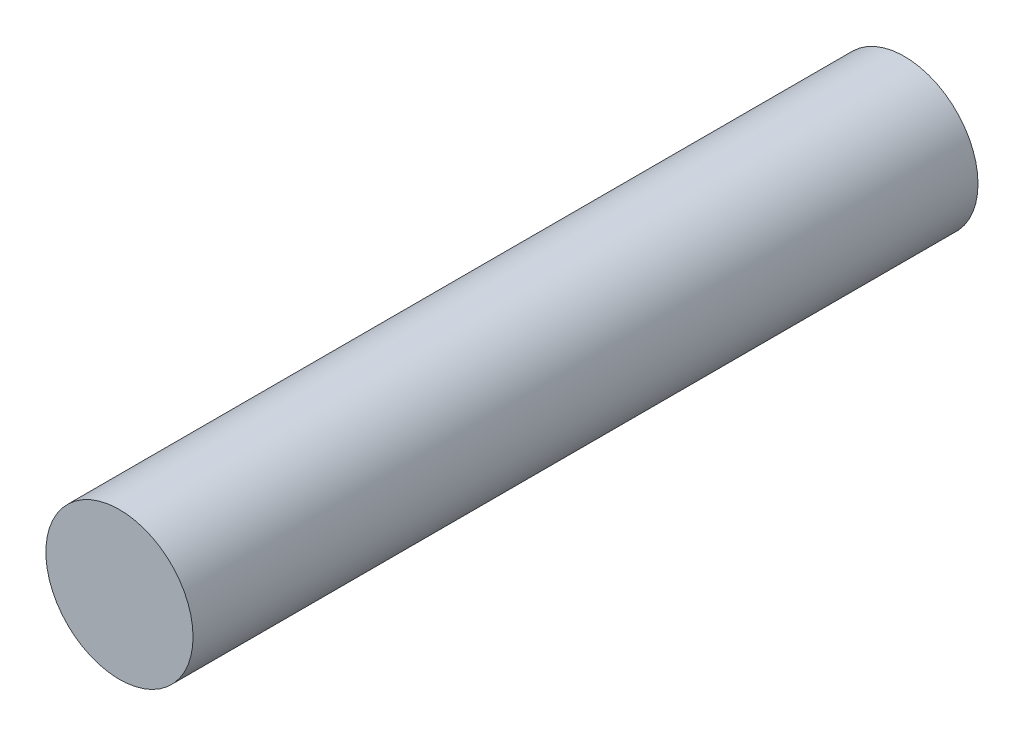
from build123d import *

# Parameters (mm, degrees)
SKETCH1_R           = 4.7625
BOSS_EXTRUDE1_DEPTH = 25.4


with BuildPart() as part:
    # Sketch1 → Boss-Extrude1 (new, symmetric)
    with BuildSketch(Plane.XY):
        Circle(SKETCH1_R)
    extrude(amount=BOSS_EXTRUDE1_DEPTH, both=True)


solid = part.part
